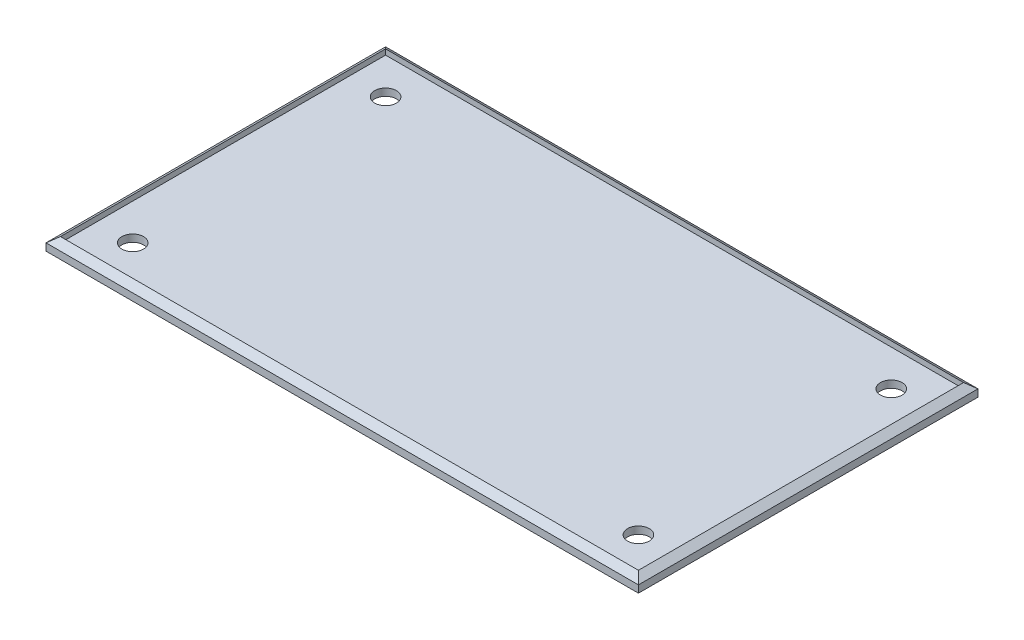
from build123d import *

# Parameters (mm, degrees)
SKETCH1_W               = 160
SKETCH1_H               = 90
BOSS_EXTRUDE1_DEPTH     = 2
BOSS_EXTRUDE2_DEPTH     = 90
BOSS_EXTRUDE5_DEPTH     = 164
CUT_EXTRUDE1_DEPTH      = 164
CUT_EXTRUDE1_DEPTH_BACK = 164
SKETCH5_R               = 3
CUT_EXTRUDE2_DEPTH      = 164


with BuildPart() as part:
    # Sketch1 → Boss-Extrude1 (new body)
    with BuildSketch(Plane(origin=(0, 0, 0), x_dir=(1, 0, 0), z_dir=(0, 1, 0))):
        Rectangle(SKETCH1_W, SKETCH1_H)
    extrude(amount=BOSS_EXTRUDE1_DEPTH)

    # Sketch2 → Boss-Extrude2 (add)
    with BuildSketch(Plane.XY.offset(45)):
        Polygon((-82, 0), (-80, 0), (-80, 3.5), (-82, 2), align=None)
        Polygon((80, 0), (82, 0), (82, 2), (80, 3.5), align=None)
    extrude(amount=-BOSS_EXTRUDE2_DEPTH)

    # Sketch3 → Boss-Extrude5 (add)
    with BuildSketch(Plane.ZY.offset(82)):
        Polygon((-47, 0), (-45, 0), (-45, 3.5), (-47, 2), align=None)
        Polygon((45, 0), (45, 3.5), (47, 2), (47, 0), align=None)
    extrude(amount=-BOSS_EXTRUDE5_DEPTH)

    # Sketch4 → Cut-Extrude1 (cut, two sides: drawn at the far end of the back side and taken through both)
    with BuildSketch(Plane.XY.offset(-45).offset(-CUT_EXTRUDE1_DEPTH_BACK)):
        Polygon((-80, 3.5), (-82, 2), (-82, 3.5), align=None)
        Polygon((80, 3.5), (82, 3.5), (82, 2), align=None)
    extrude(amount=CUT_EXTRUDE1_DEPTH + CUT_EXTRUDE1_DEPTH_BACK, mode=Mode.SUBTRACT)

    # Sketch5 → Cut-Extrude2 (cut)
    with BuildSketch(Plane(origin=(0, 2, 0), x_dir=(1, 0, 0), z_dir=(0, 1, 0))):
        with Locations(Location((-70, 35, 0), (0, 0, 270))):
            Circle(SKETCH5_R)
        with Locations(Location((70, 35, 0), (0, 0, 270))):
            Circle(SKETCH5_R)
        with Locations(Location((70, -35, 0), (0, 0, 270))):
            Circle(SKETCH5_R)
        with Locations(Location((-70, -35, 0), (0, 0, 270))):
            Circle(SKETCH5_R)
    extrude(amount=-CUT_EXTRUDE2_DEPTH, mode=Mode.SUBTRACT)


solid = part.part
